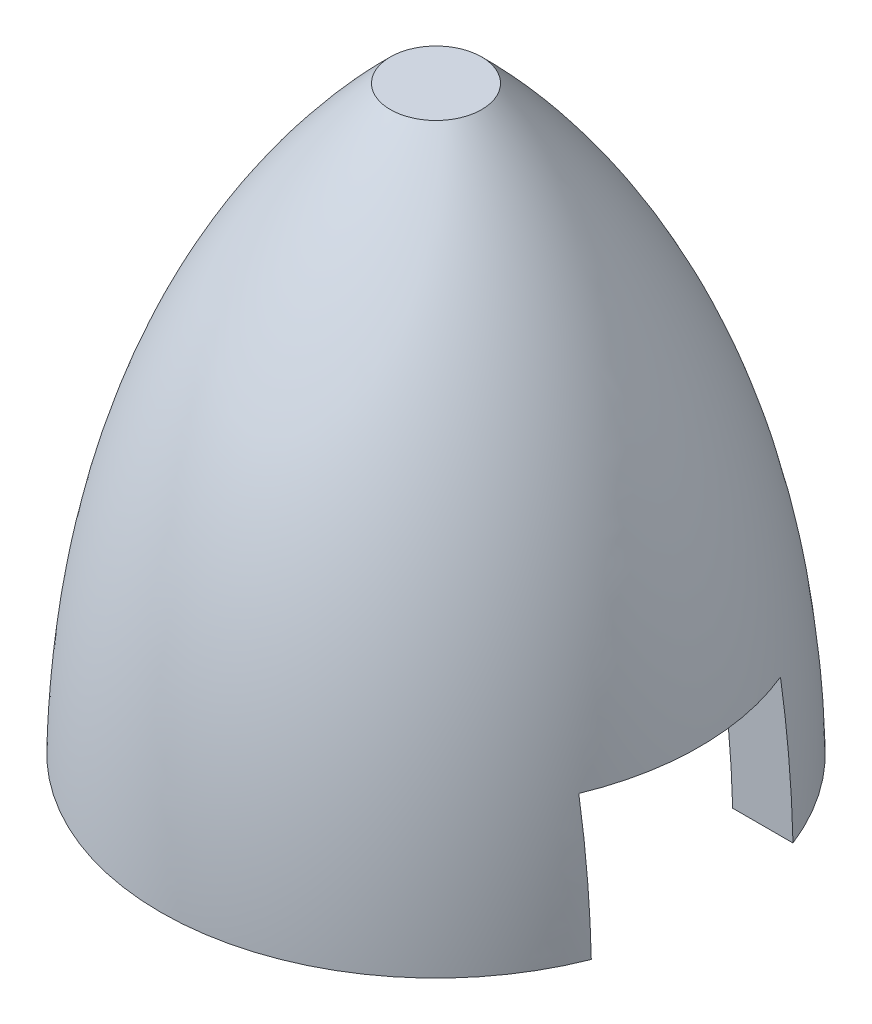
from build123d import *

# Parameters (mm, degrees)
SKETCH7_W          = 11
SKETCH7_H          = 15
CUT_EXTRUDE1_DEPTH = 25


with BuildPart() as part:
    # Sketch5 → Revolve1 (revolve)
    with BuildSketch(Plane(origin=(0, 0, 0), x_dir=(0, 0, -1), z_dir=(1, 0, 0))):
        with BuildLine():
            Line((2.490024074, 31.65), (0, 31.65))
            Line((0, 31.65), (0, 28.65))
            Line((0, 28.65), (1.232368986, 28.65))
            add(Edge.make_bspline(
                [(1.232368986, 28.65), (5.104611676, 24.582684724), (9.236488686, 16.227440671), (11.84122808, 6.75314374), (12.012195966, 0)],
                knots=[0, 0, 0, 0.34321643, 0.572027383, 0.913485349, 0.913485349, 0.913485349], degree=2))
            Line((12.012195966, 0), (15.013112958, 0))
            add(Edge.make_bspline(
                [(15.013112958, 0), (14.554887046, 19.750256948), (2.490024074, 31.65)],
                knots=[0, 0, 0, 0.952040092, 0.952040092, 0.952040092], degree=2))
        make_face()
    revolve(axis=Axis((0, 0, 0), (0, 1, 0)))

    # Sketch7 → Cut-Extrude1 (cut, symmetric)
    with BuildSketch(Plane(origin=(0, 0, 0), x_dir=(0, 0, -1), z_dir=(1, 0, 0))):
        Rectangle(SKETCH7_W, SKETCH7_H)
    extrude(amount=CUT_EXTRUDE1_DEPTH, both=True, mode=Mode.SUBTRACT)


solid = part.part
